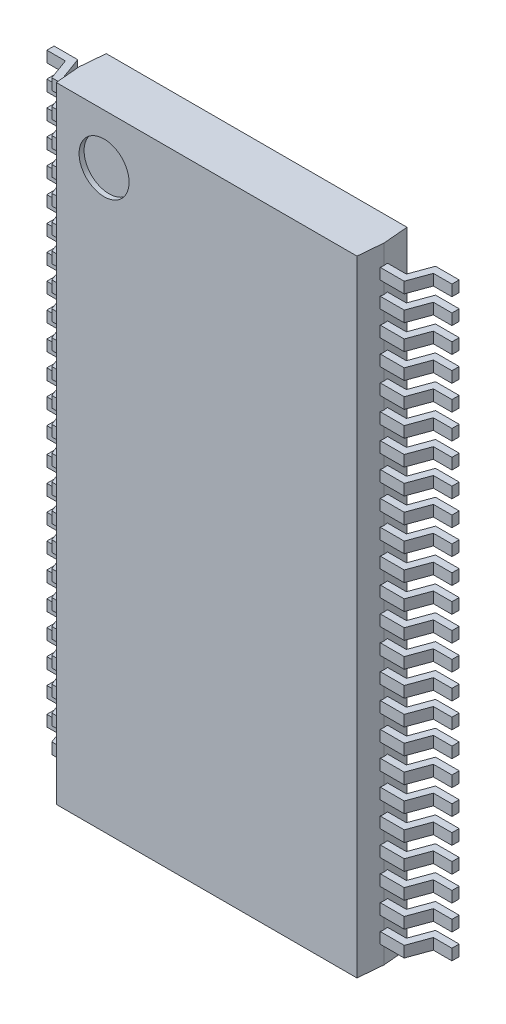
from build123d import *

# Parameters (mm, degrees)
BODY_DEPTH         = 6.25
SKETCH3_R          = 0.5
PIN_1_MARK_DEPTH   = 0.1
LEAD_START         = -0.39
LEAD_PROFILE_DEPTH = 0.22
LEADS_COUNT        = 24
LEADS_PITCH        = 0.5


with BuildPart() as part:
    # Sketch1 → Body (new, symmetric)
    with BuildSketch(Plane(origin=(0, 0, 0), x_dir=(1, 0, 0), z_dir=(0, 1, 0))):
        Polygon((-3.05, -0.5), (-3.006255668, -1), (3.006255668, -1), (3.05, -0.5), (3.006255668, 0), (-3.006255668, 0), align=None)
    extrude(amount=BODY_DEPTH, both=True)

    # Sketch3 → Pin 1 Mark (cut)
    with BuildSketch(Plane.XY.offset(1)):
        with Locations((-2.05, 5.25)):
            Circle(SKETCH3_R)
    extrude(amount=-PIN_1_MARK_DEPTH, mode=Mode.SUBTRACT)

    # Sketch2 → Lead Profile (add)
    with BuildSketch(Plane(origin=(0, 6.25, 0), x_dir=(1, 0, 0), z_dir=(0, 1, 0)).offset(LEAD_START)):
        Polygon((-3.006255668, -0.4275), (-3.05, -0.4275), (-3.421436316, -0.4275), (-3.577033591, 0), (-4.05, 0), (-4.05, -0.145), (-3.678563684, -0.145), (-3.522966409, -0.5725), (-3.05, -0.5725), (-3.006255668, -0.5725), align=None)
        Polygon((3.006255668, -0.5725), (3.05, -0.5725), (3.522966409, -0.5725), (3.678563684, -0.145), (4.05, -0.145), (4.05, 0), (3.577033591, 0), (3.421436316, -0.4275), (3.05, -0.4275), (3.006255668, -0.4275), align=None)
    lead_profile = extrude(amount=-LEAD_PROFILE_DEPTH)

    # Leads: Lead Profile ×24
    with Locations(*[(0, -i * LEADS_PITCH, 0) for i in range(1, LEADS_COUNT)]):
        add(lead_profile)


solid = part.part
